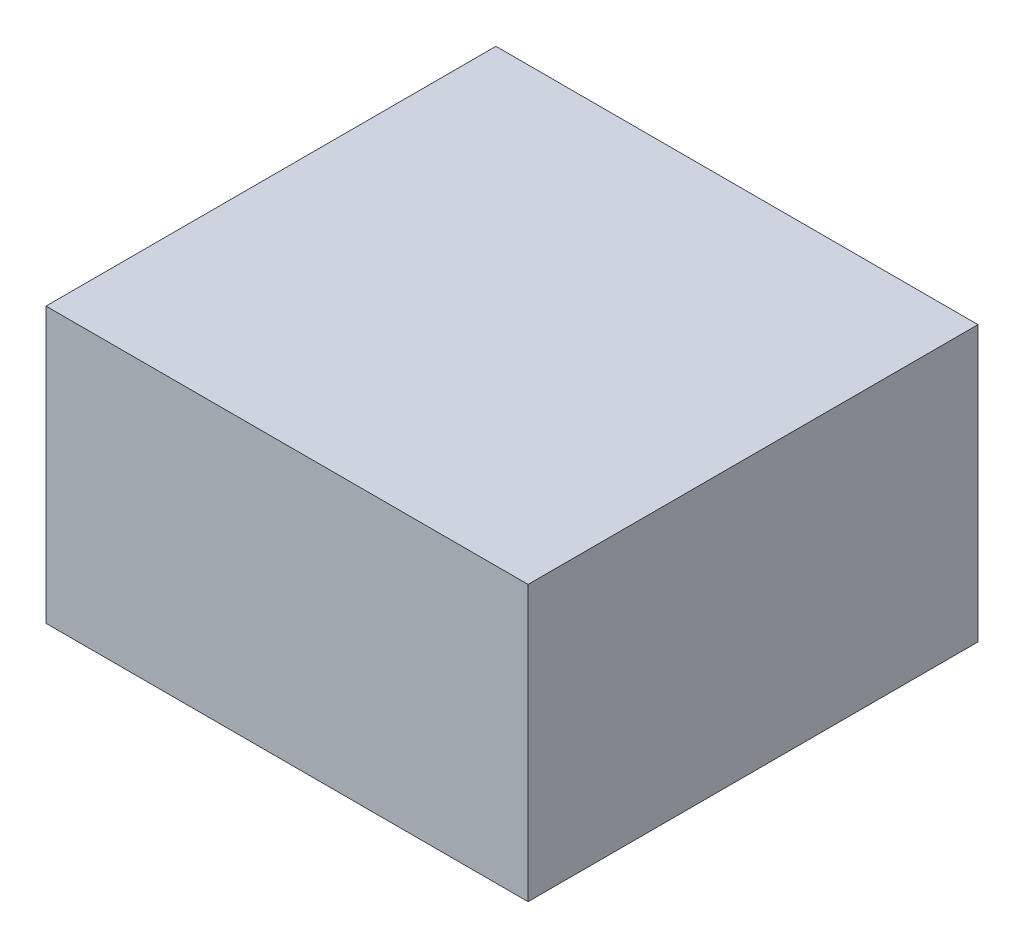
from build123d import *

# Parameters (mm, degrees)
SKETCH1_W           = 150
SKETCH1_H           = 140
BOSS_EXTRUDE1_DEPTH = 85.5


with BuildPart() as part:
    # Sketch1 → Boss-Extrude1 (new body)
    with BuildSketch(Plane(origin=(0, 0, 0), x_dir=(1, 0, 0), z_dir=(0, 1, 0))):
        Rectangle(SKETCH1_W, SKETCH1_H)
    extrude(amount=BOSS_EXTRUDE1_DEPTH)


solid = part.part
